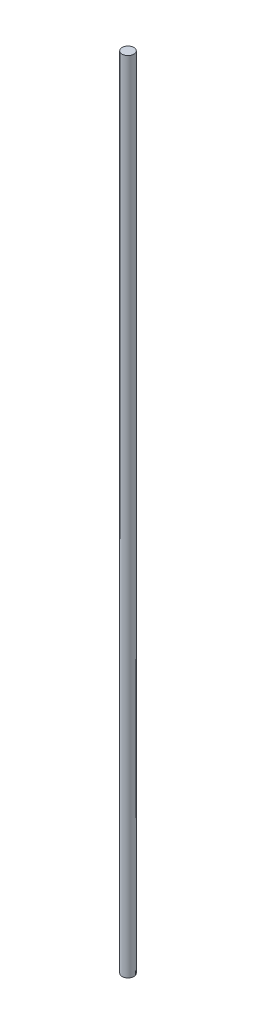
from build123d import *

# Parameters (mm, degrees)
BOSS_EXTRUDE1_DEPTH      = 170
BOSS_EXTRUDE1_DEPTH_BACK = 170
SKETCH1_R                = 2.5


with BuildPart() as part:
    # Sketch1 → Boss-Extrude1 (new, two sides: drawn at the far end of the back side and taken through both)
    with BuildSketch(Plane(origin=(0, 0, 0), x_dir=(1, 0, 0), z_dir=(0, 1, 0)).offset(-BOSS_EXTRUDE1_DEPTH_BACK)):
        Circle(SKETCH1_R)
    extrude(amount=BOSS_EXTRUDE1_DEPTH + BOSS_EXTRUDE1_DEPTH_BACK)


solid = part.part
